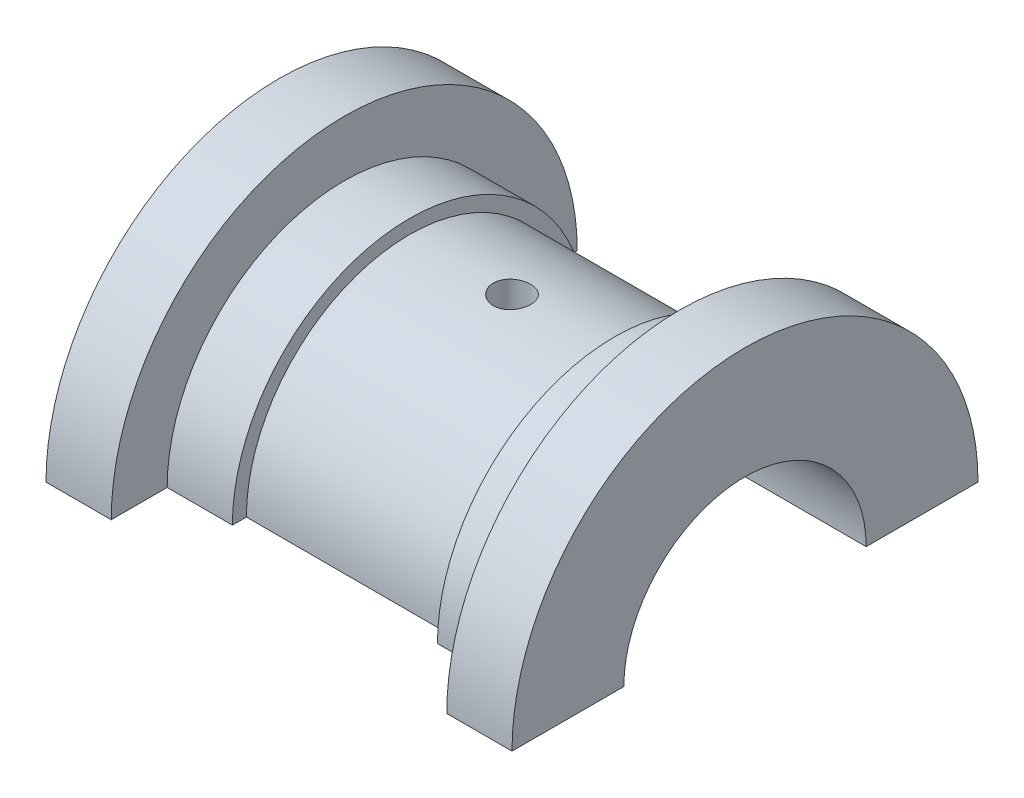
from build123d import *

# Parameters (mm, degrees)
BOSS_EXTRUDE4_DEPTH     = 50
CUT_EXTRUDE_THIN1_DEPTH = 50
BOSS_EXTRUDE6_DEPTH     = 7
BOSS_EXTRUDE8_START     = -7
BOSS_EXTRUDE8_DEPTH     = 7
BOSS_EXTRUDE9_START     = 7
BOSS_EXTRUDE9_DEPTH     = 7
SKETCH10_R              = 2
CUT_EXTRUDE1_DEPTH      = 59.576872569


with BuildPart() as part:
    # Sketch1 → Boss-Extrude4 (new body)
    with BuildSketch(Plane(origin=(0, 0, 0), x_dir=(0, 0, -1), z_dir=(1, 0, 0))):
        with BuildLine():
            Line((-25, 0), (-13, 0))
            ThreePointArc((-13, 0), (0, 13), (13, 0))
            Line((13, 0), (25, 0))
            ThreePointArc((25, 0), (0, 25), (-25, 0))
        make_face()
    extrude(amount=BOSS_EXTRUDE4_DEPTH)

    # Sketch4 → Cut-Extrude-Thin1 (cut)
    with BuildSketch(Plane.ZY.offset(-7)):
        with BuildLine():
            ThreePointArc((17.5, 0), (0, 17.5), (-17.5, 0))
            Line((-17.5, 0), (-27.5, 0))
            ThreePointArc((-27.5, 0), (0, 27.5), (27.5, 0))
            Line((27.5, 0), (17.5, 0))
        make_face()
    extrude(amount=-CUT_EXTRUDE_THIN1_DEPTH, mode=Mode.SUBTRACT)

    # Sketch5 → Boss-Extrude6 (add)
    with BuildSketch(Plane(origin=(7, 0, 0), x_dir=(0, 0, -1), z_dir=(1, 0, 0))):
        with BuildLine():
            Line((-19, 0), (-17.5, 0))
            ThreePointArc((-17.5, 0), (0, 17.5), (17.5, 0))
            Line((17.5, 0), (19, 0))
            ThreePointArc((19, 0), (0, 19), (-19, 0))
        make_face()
    extrude(amount=BOSS_EXTRUDE6_DEPTH)

    # Sketch8 → Boss-Extrude8 (add)
    with BuildSketch(Plane(origin=(50, 0, 0), x_dir=(0, 0, -1), z_dir=(1, 0, 0)).offset(BOSS_EXTRUDE8_START)):
        with BuildLine():
            Line((-25, 0), (-17.5, 0))
            ThreePointArc((-17.5, 0), (0, 17.5), (17.5, 0))
            Line((17.5, 0), (25, 0))
            ThreePointArc((25, 0), (0, 25), (-25, 0))
        make_face()
    extrude(amount=BOSS_EXTRUDE8_DEPTH)

    # Sketch9 → Boss-Extrude9 (add)
    with BuildSketch(Plane.ZY.offset(-43).offset(BOSS_EXTRUDE9_START)):
        with BuildLine():
            Line((-19, 0), (-17.5, 0))
            ThreePointArc((-17.5, 0), (0, 17.5), (17.5, 0))
            Line((17.5, 0), (19, 0))
            ThreePointArc((19, 0), (0, 19), (-19, 0))
        make_face()
    extrude(amount=-BOSS_EXTRUDE9_DEPTH)

    # Sketch10 → Cut-Extrude1 (cut, through all)
    with BuildSketch(Plane(origin=(0, 17.5, 0), x_dir=(1, 0, 0), z_dir=(0, 1, 0))):
        with Locations(Location((25, 0, 0), (0, 0, 270))):
            Circle(SKETCH10_R)
    extrude(amount=-CUT_EXTRUDE1_DEPTH, mode=Mode.SUBTRACT)


solid = part.part
